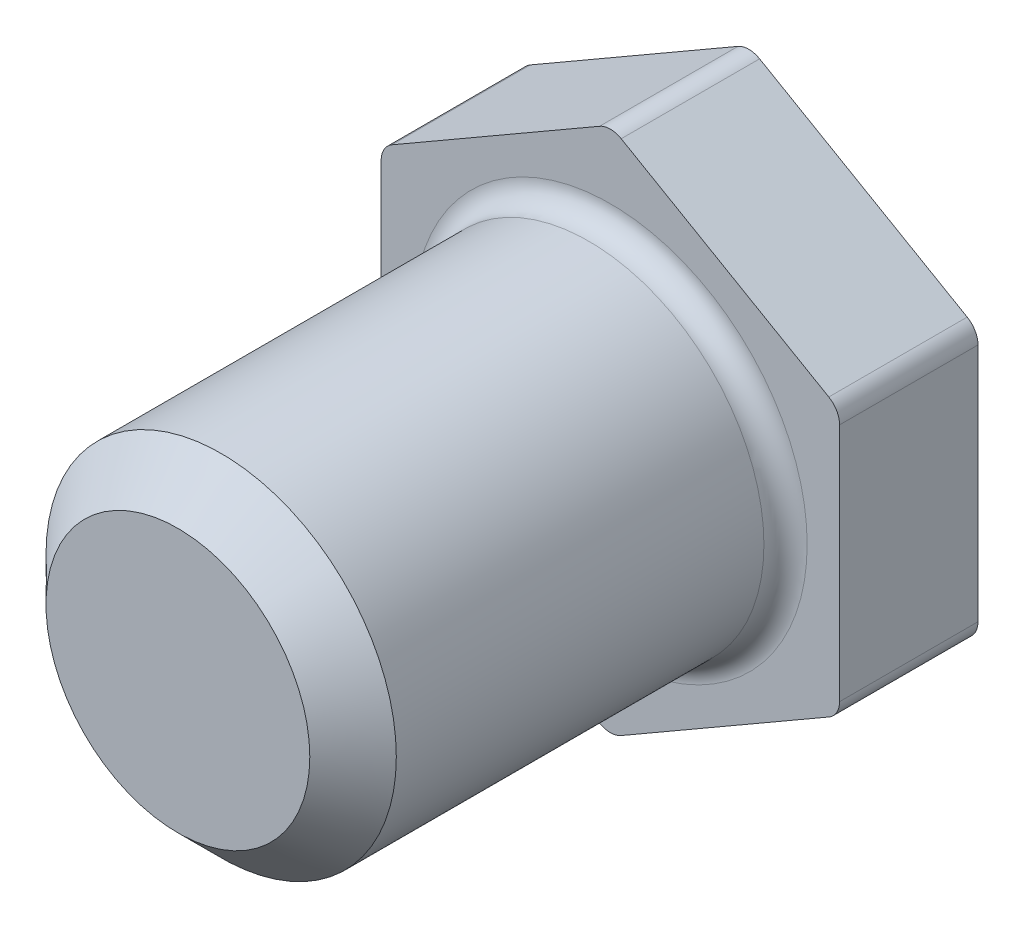
from build123d import *

# Parameters (mm, degrees)
BOSS_EXTRUDE1_DEPTH = 3.2
SKETCH2_R           = 4.05
BOSS_EXTRUDE2_DEPTH = 10
FILLET1_R           = 0.5
CHAMFER1_SIZE       = 1


with BuildPart() as part:
    # Sketch1 → Boss-Extrude1 (new body)
    with BuildSketch(Plane.XY):
        Polygon((5.3, 3.059956427), (0, 6.119912853), (-5.3, 3.059956427), (-5.3, -3.059956427), (0, -6.119912853), (5.3, -3.059956427), align=None)
    extrude(amount=BOSS_EXTRUDE1_DEPTH)

    # Sketch2 → Boss-Extrude2 (add)
    with BuildSketch(Plane.XY.offset(3.2)):
        Circle(SKETCH2_R)
    extrude(amount=BOSS_EXTRUDE2_DEPTH)

    # Fillet1
    fillet1_edges = [part.edges().sort_by_distance(p)[0] for p in [
        (5.3, -3.059956427, 1.6),
        (0, -6.119912853, 1.6),
        (-5.3, -3.059956427, 1.6),
        (-5.3, 3.059956427, 1.6),
        (0, 6.119912853, 1.6),
        (5.3, 3.059956427, 1.6),
        (-4.05, 0, 3.2),
    ]]
    fillet(fillet1_edges, radius=FILLET1_R)

    # Chamfer1
    chamfer1_edges = [part.edges().sort_by_distance(p)[0] for p in [
        (-4.05, 0, 13.2),
    ]]
    chamfer(chamfer1_edges, length=CHAMFER1_SIZE)


solid = part.part
